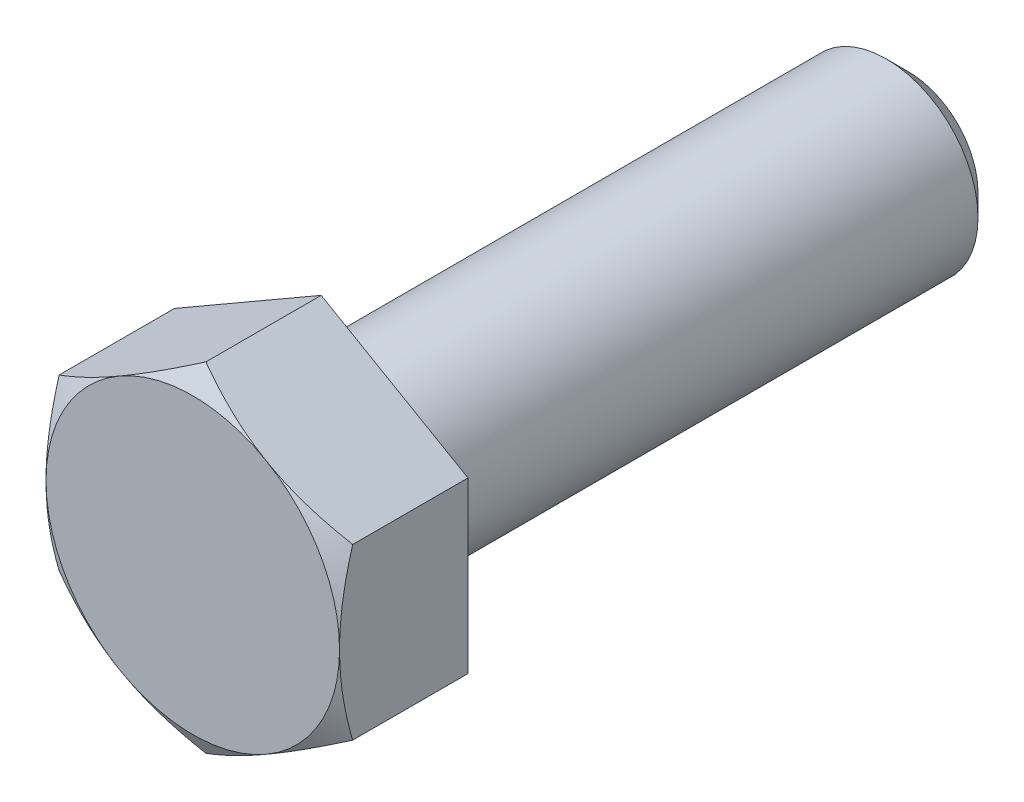
from build123d import *

# Parameters (mm, degrees)
BOSS_EXTRUDE1_DEPTH = 3.5
SKETCH4_OUTSIDE_W   = 88.856
SKETCH4_OUTSIDE_H   = 90.094
SKETCH4_OUTSIDE_R   = 4
CUT_EXTRUDE1_DEPTH  = 21.434855843
CUT_EXTRUDE1_DRAFT  = -60


with BuildPart() as part:
    # Sketch2 → Revolve1 (revolve)
    with BuildSketch(Plane(origin=(0, 0, 0), x_dir=(0, 0, -1), z_dir=(1, 0, 0)), mode=Mode.PRIVATE) as revolve1_sk:
        Polygon((-9.75, 4), (-9.75, 0), (9.75, 0), (9.75, 1.9), (9.15, 2.5), (-6.25, 2.5), (-6.25, 4), align=None)
    revolve(revolve1_sk.sketch.rotate(Axis((0, 0, 9.75), (0, 0, -1)), 90), axis=Axis((0, 0, 9.75), (0, 0, -1)))

    # Sketch3 → Boss-Extrude1 (add)
    with BuildSketch(Plane.XY.offset(9.75)):
        Polygon((0, 4.618802154), (-4, 2.309401077), (-4, -2.309401077), (0, -4.618802154), (4, -2.309401077), (4, 2.309401077), align=None)
    extrude(amount=-BOSS_EXTRUDE1_DEPTH)


with BuildPart() as cut_extrude1_tool:
    # Sketch4 outside → Cut-Extrude1 (with draft: the straight prism first)
    with BuildSketch(Plane.XY.offset(9.75)):
        Rectangle(SKETCH4_OUTSIDE_W, SKETCH4_OUTSIDE_H)
        Circle(SKETCH4_OUTSIDE_R, mode=Mode.SUBTRACT)
    extrude(amount=-CUT_EXTRUDE1_DEPTH)
    # Cut-Extrude1: the draft: its side faces are tilted about the plane it starts from
    cut_extrude1_sides = [cut_extrude1_tool.faces().sort_by_distance(p)[0] for p in [
        (0, -45.047, -0.967427922),
        (44.428, 0, -0.967427922),
        (0, 45.047, -0.967427922),
        (-44.428, 0, -0.967427922),
        (-4, 0, -0.967427922),
    ]]
    draft(cut_extrude1_sides, Plane.XY.offset(9.75), CUT_EXTRUDE1_DRAFT)


with BuildPart() as part_1:
    add(part.part)

    # Cut-Extrude1: cut by cut_extrude1_tool
    add(cut_extrude1_tool.part, mode=Mode.SUBTRACT)


solid = part_1.part
